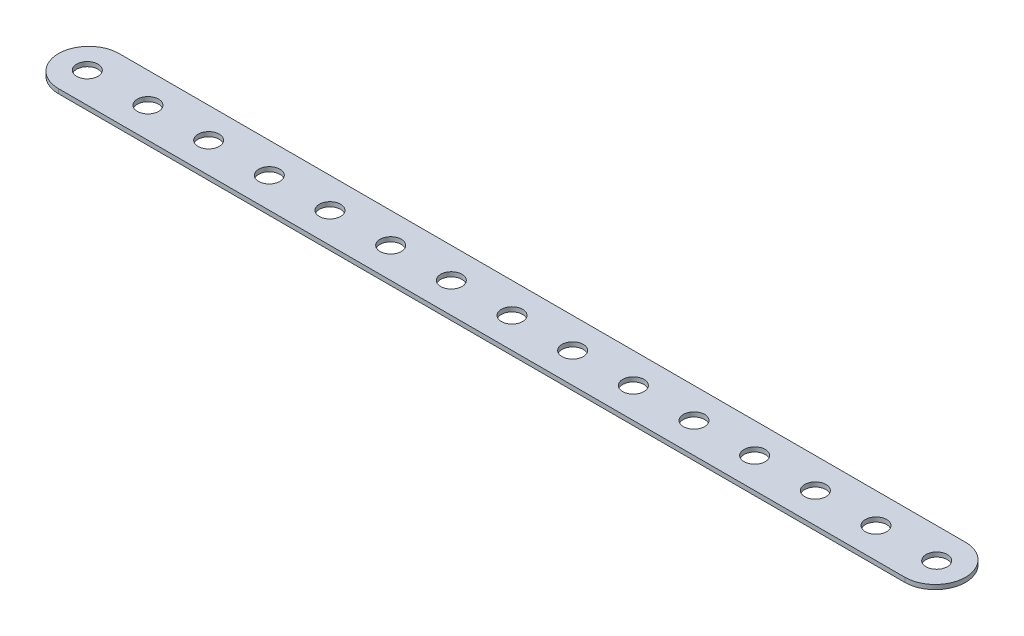
from build123d import *

# Parameters (mm, degrees)
SKETCH1_R                = 2.2225
BAR_DEPTH                = 0.9398
SKETCH2_R                = 2.2225
CENTER_HOLE_DEPTH        = 184.62723368
OTHER_CENTER_HOLES_COUNT = 13
OTHER_CENTER_HOLES_PITCH = 12.7


with BuildPart() as part:
    # Sketch1 → Bar (new body)
    with BuildSketch(Plane(origin=(0, 0, 0), x_dir=(-1, 0, 0), z_dir=(0, 1, 0))):
        with BuildLine():
            Line((177.165, 6.35), (0, 6.35))
            ThreePointArc((0, 6.35), (-6.35, 0), (0, -6.35))
            Line((0, -6.35), (177.165, -6.35))
            ThreePointArc((177.165, -6.35), (183.515, 0), (177.165, 6.35))
        make_face()
        with Locations(Location((177.4825, 0, 0), (0, 0, 90))):
            Circle(SKETCH1_R, mode=Mode.SUBTRACT)
        with Locations(Location((-0.3175, 0, 0), (0, 0, 90))):
            Circle(SKETCH1_R, mode=Mode.SUBTRACT)
    extrude(amount=BAR_DEPTH)

    # Sketch2 → Center Hole (cut, through all)
    with BuildSketch(Plane(origin=(0, 0.9398, 0), x_dir=(1, 0, 0), z_dir=(0, 1, 0))):
        with Locations(Location((-164.7825, 0, 0), (0, 0, 270))):
            Circle(SKETCH2_R)
    center_hole = extrude(amount=-CENTER_HOLE_DEPTH, mode=Mode.SUBTRACT)

    # Other Center Holes: Center Hole ×13
    with Locations(*[(i * OTHER_CENTER_HOLES_PITCH, 0, 0) for i in range(1, OTHER_CENTER_HOLES_COUNT)]):
        add(center_hole, mode=Mode.SUBTRACT)


solid = part.part
